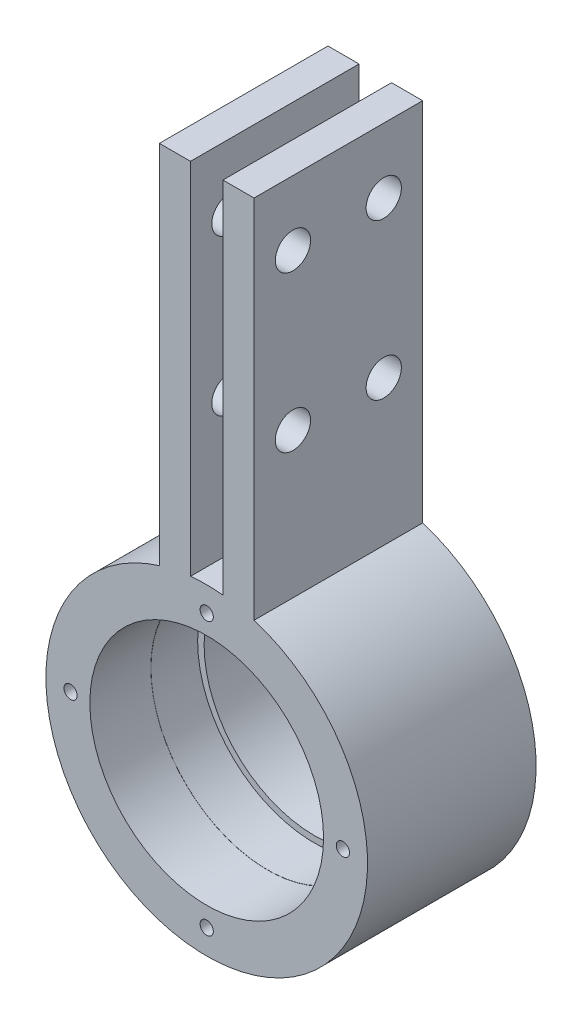
from build123d import *

# Parameters (mm, degrees)
SKETCH1_R              = 42.5
BOSS_EXTRUDE1_DEPTH    = 65
SKETCH2_R              = 45.05
CUT_EXTRUDE1_DEPTH     = 23.5
SKETCH3_R              = 44.9925
CUT_EXTRUDE2_DEPTH     = 18
M6_TAPPED_HOLE1_D      = 5.1
M6_TAPPED_HOLE1_DEPTH  = 12
M6_TAPPED_HOLE1_TIP    = 1.532194579
M6_TAPPED_HOLE2_D      = 5.1
M6_TAPPED_HOLE2_DEPTH  = 12
M6_TAPPED_HOLE2_TIP    = 1.532194579
F_12_0MM_DOWEL_HOLE1_D = 13.6


with BuildPart() as part:
    # Sketch1 → Boss-Extrude1 (new body)
    with BuildSketch(Plane.XY):
        with BuildLine():
            Line((6.25, 200.253164472), (6.25, 61.684175442))
            ThreePointArc((6.25, 61.684175442), (0, 62), (-6.25, 61.684175442))
            Line((-6.25, 61.684175442), (-6.25, 200.253164472))
            Line((-6.25, 200.253164472), (-18.25, 200.253164472))
            Line((-18.25, 200.253164472), (-18.25, 59.253164472))
            ThreePointArc((-18.25, 59.253164472), (0, -62), (18.25, 59.253164472))
            Line((18.25, 59.253164472), (18.25, 200.253164472))
            Line((18.25, 200.253164472), (6.25, 200.253164472))
        make_face()
        Circle(SKETCH1_R, mode=Mode.SUBTRACT)
    extrude(amount=BOSS_EXTRUDE1_DEPTH)

    # Sketch2 → Cut-Extrude1 (cut)
    with BuildSketch(Plane.XY.offset(65)):
        Circle(SKETCH2_R)
    extrude(amount=-CUT_EXTRUDE1_DEPTH, mode=Mode.SUBTRACT)

    # Sketch3 → Cut-Extrude2 (cut)
    with BuildSketch(Plane.XY.offset(41.5)):
        Circle(SKETCH3_R)
    extrude(amount=-CUT_EXTRUDE2_DEPTH, mode=Mode.SUBTRACT)

    # M6 Tapped Hole1
    with Locations(Plane.XY.offset(65)):
        with Locations((0, -52.5), (-52.5, 0), (0, 52.5), (52.5, 0)):
            Hole(M6_TAPPED_HOLE1_D / 2, depth=M6_TAPPED_HOLE1_DEPTH)
            with Locations((0, 0, -(M6_TAPPED_HOLE1_DEPTH + M6_TAPPED_HOLE1_TIP / 2))):  # 118° drill point
                Cone(0, M6_TAPPED_HOLE1_D / 2, M6_TAPPED_HOLE1_TIP, mode=Mode.SUBTRACT)

    # M6 Tapped Hole2
    with Locations(Plane(origin=(0, 0, 0), x_dir=(-1, 0, 0), z_dir=(0, 0, -1))):
        with Locations((-52.5, 0), (0, 52.5), (52.5, 0), (0, -52.5)):
            Hole(M6_TAPPED_HOLE2_D / 2, depth=M6_TAPPED_HOLE2_DEPTH)
            with Locations((0, 0, -(M6_TAPPED_HOLE2_DEPTH + M6_TAPPED_HOLE2_TIP / 2))):  # 118° drill point
                Cone(0, M6_TAPPED_HOLE2_D / 2, M6_TAPPED_HOLE2_TIP, mode=Mode.SUBTRACT)

    # Ø12.0mm Dowel Hole1 (through all)
    with Locations(Plane(origin=(18.25, 0, 0), x_dir=(0, 0, -1), z_dir=(1, 0, 0))):
        with Locations((-50, 175.253164472), (-15, 175.253164472), (-15, 115.253164472), (-50, 115.253164472)):
            Hole(F_12_0MM_DOWEL_HOLE1_D / 2)


solid = part.part
